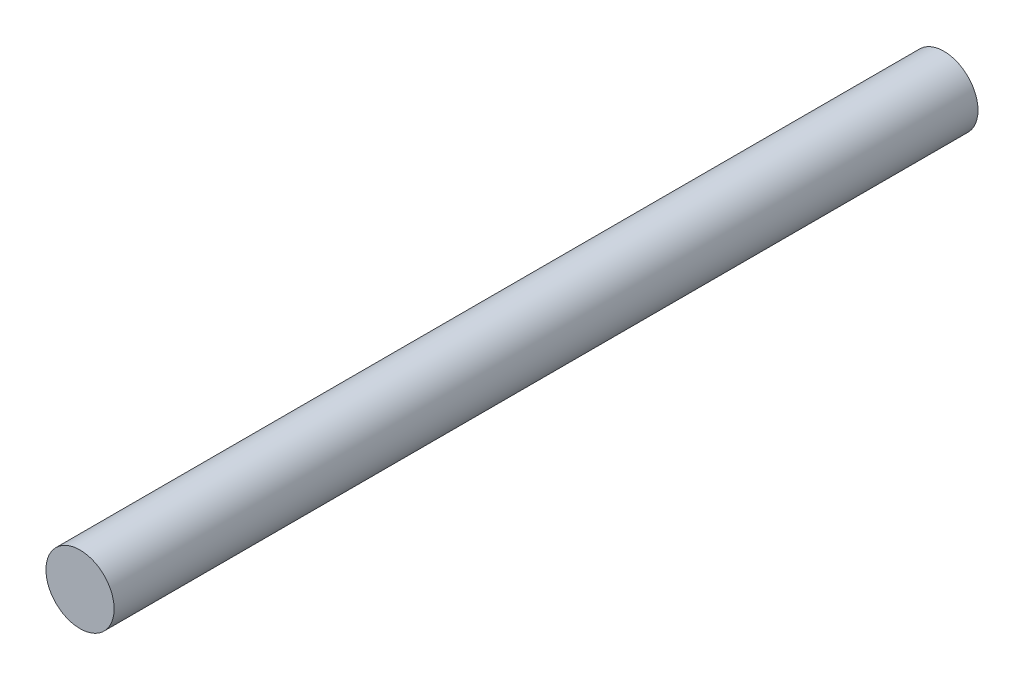
from build123d import *

# Parameters (mm, degrees)
SKETCH_1_R      = 1.5
EXTRUDE_1_DEPTH = 38


with BuildPart() as part:
    # 草圖1 → 填料-伸長1 (new body)
    with BuildSketch(Plane.XY):
        with Locations((-16.137054119, 5.974510283)):
            Circle(SKETCH_1_R)
    extrude(amount=EXTRUDE_1_DEPTH)


solid = part.part
